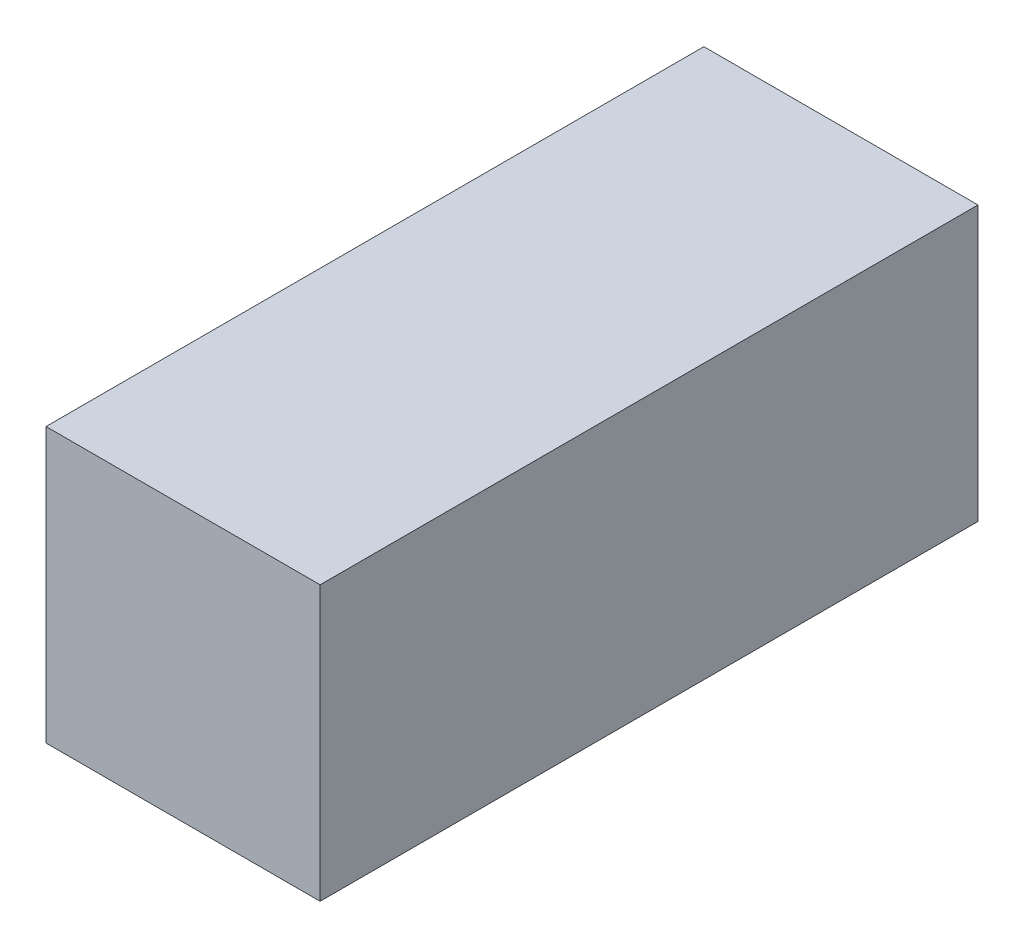
from build123d import *

# Parameters (mm, degrees)
REACTION_KEY_START = -29.75
SKETCH_1_W         = 5
SKETCH_1_H         = 5
REACTION_KEY_DEPTH = 12


with BuildPart() as part:
    # Эскиз1 → Reaction_key (new body)
    with BuildSketch(Plane.XY.offset(REACTION_KEY_START)):
        with Locations((8, 0)):
            Rectangle(SKETCH_1_W, SKETCH_1_H)
    extrude(amount=REACTION_KEY_DEPTH)


solid = part.part
